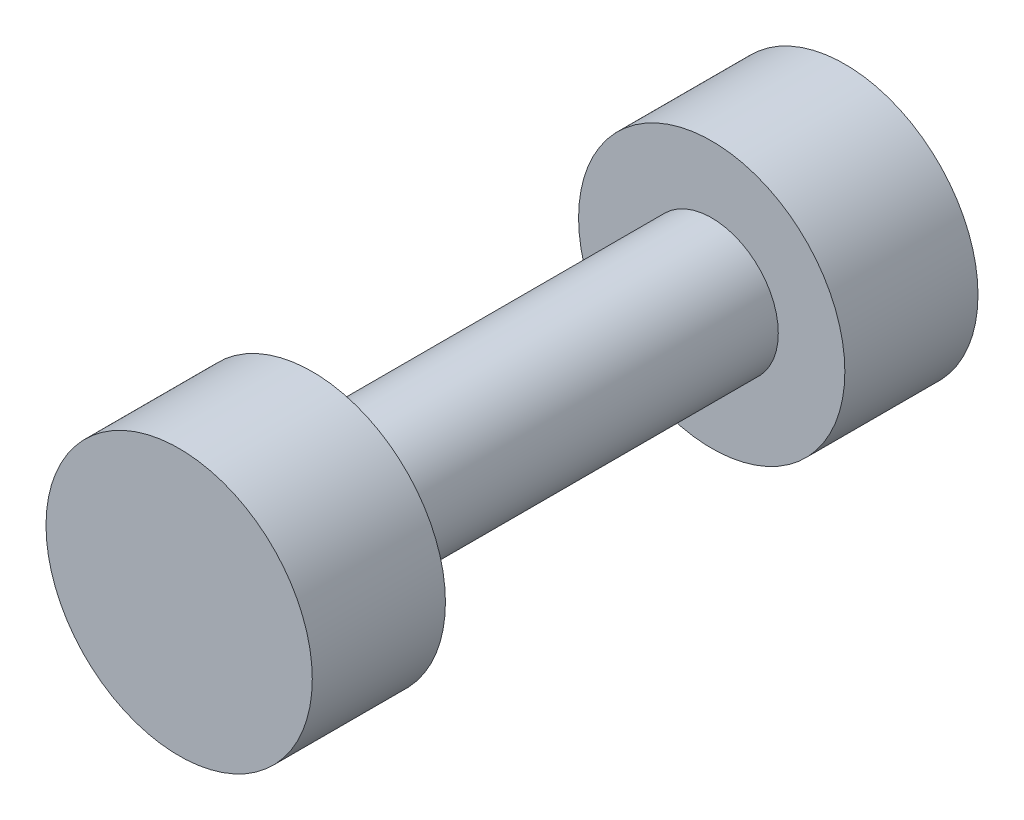
from build123d import *

# Parameters (mm, degrees)
SKETCH1_R           = 0.5
BOSS_EXTRUDE1_DEPTH = 1.5
SKETCH2_R           = 1
BOSS_EXTRUDE2_DEPTH = 1


with BuildPart() as part:
    # Sketch1 → Boss-Extrude1 (new, symmetric)
    with BuildSketch(Plane.XY):
        Circle(SKETCH1_R)
    extrude(amount=BOSS_EXTRUDE1_DEPTH, both=True)

    # Sketch2 → Boss-Extrude2 (add)
    with BuildSketch(Plane.XY.offset(1.5)):
        Circle(SKETCH2_R)
    boss_extrude2 = extrude(amount=BOSS_EXTRUDE2_DEPTH)

    # Mirror1: Boss-Extrude2 across plane
    add(boss_extrude2.mirror(Plane.XY))


solid = part.part
